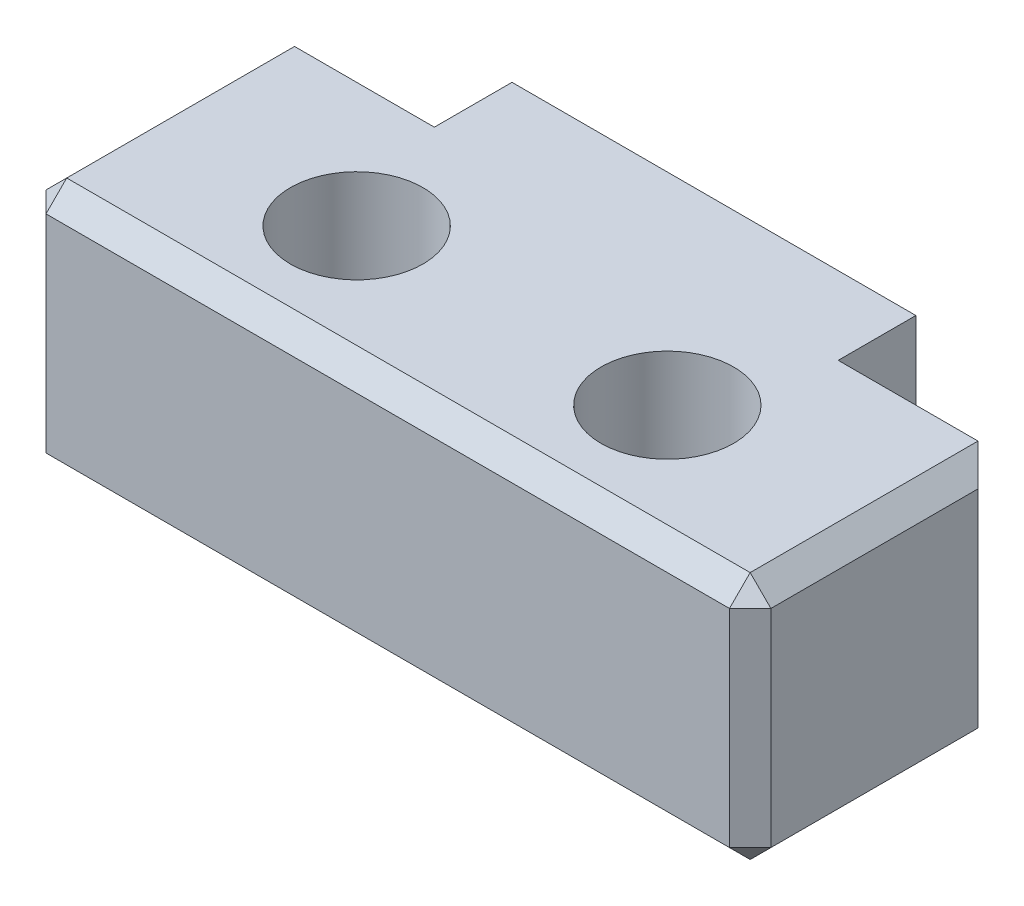
from build123d import *

# Parameters (mm, degrees)
SKETCH1_W            = 35
SKETCH1_H            = 12
BOSS_EXTRUDE1_DEPTH  = 6
SKETCH3_W            = 19.5
SKETCH3_H            = 4.75
BOSS_EXTRUDE2_DEPTH  = 12
M6_CLEARANCE_HOLE1_D = 6.4
CHAMFER4_SIZE        = 1


with BuildPart() as part:
    # Sketch1 → Boss-Extrude1 (new, symmetric)
    with BuildSketch(Plane.XY):
        Rectangle(SKETCH1_W, SKETCH1_H)
    extrude(amount=BOSS_EXTRUDE1_DEPTH, both=True)

    # Sketch3 → Boss-Extrude2 (add)
    with BuildSketch(Plane(origin=(0, 6, 0), x_dir=(1, 0, 0), z_dir=(0, 1, 0))):
        with Locations((0, 8.375)):
            Rectangle(SKETCH3_W, SKETCH3_H)
    extrude(amount=-BOSS_EXTRUDE2_DEPTH)

    # M6 Clearance Hole1 (through all)
    with Locations(Plane(origin=(0, 6, 0), x_dir=(1, 0, 0), z_dir=(0, 1, 0))):
        with Locations((-7.5, 0), (7.5, 0)):
            Hole(M6_CLEARANCE_HOLE1_D / 2)

    # Chamfer4
    chamfer4_edges = [part.edges().sort_by_distance(p)[0] for p in [
        (-17.5, 0, 6),
        (0, -6, 6),
        (-9.75, 0, -10.75),
        (9.75, 0, -10.75),
        (0, 6, -10.75),
        (0, -6, -10.75),
        (17.5, 0, 6),
        (-17.5, 0, -6),
        (17.5, 0, -6),
        (17.5, -6, 0),
        (-17.5, -6, 0),
        (-17.5, 6, 0),
        (17.5, 6, 0),
        (0, 6, 6),
    ]]
    chamfer(chamfer4_edges, length=CHAMFER4_SIZE)


solid = part.part
